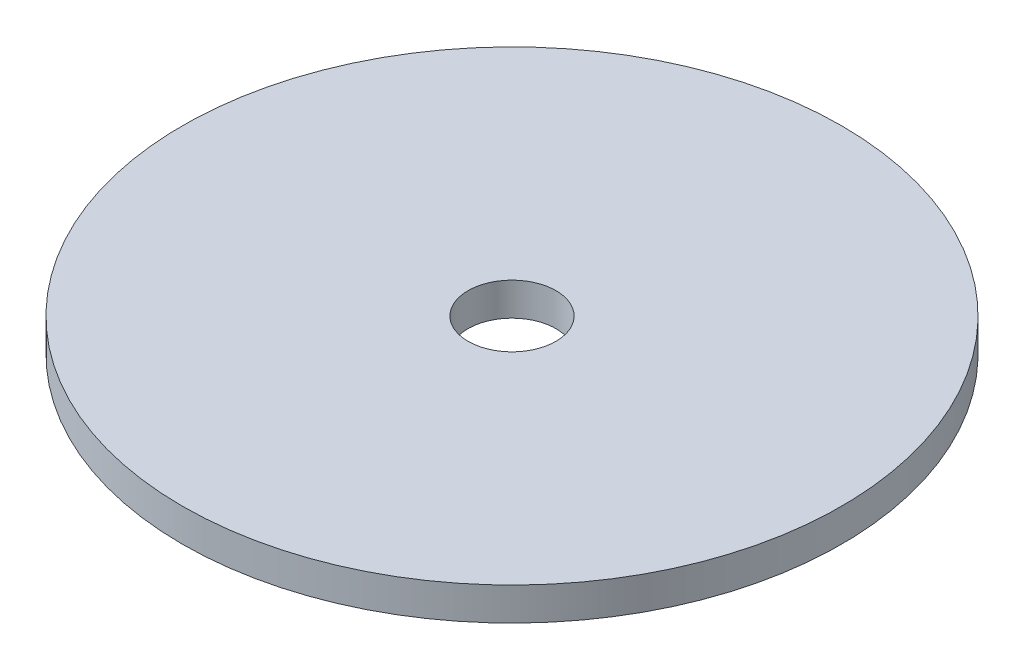
from build123d import *

# Parameters (mm, degrees)
ESQUISSE1_R        = 30
ESQUISSE1_R_2      = 4
BOSS_EXTRU_1_DEPTH = 3


with BuildPart() as part:
    # Esquisse1 → Boss.-Extru.1 (new body)
    with BuildSketch(Plane(origin=(0, 0, 0), x_dir=(1, 0, 0), z_dir=(0, 1, 0))):
        with Locations(Location((0, 0, 0), (0, 0, 270))):
            Circle(ESQUISSE1_R)
        with Locations(Location((0, 0, 0), (0, 0, 270))):
            Circle(ESQUISSE1_R_2, mode=Mode.SUBTRACT)
    extrude(amount=BOSS_EXTRU_1_DEPTH)


solid = part.part
